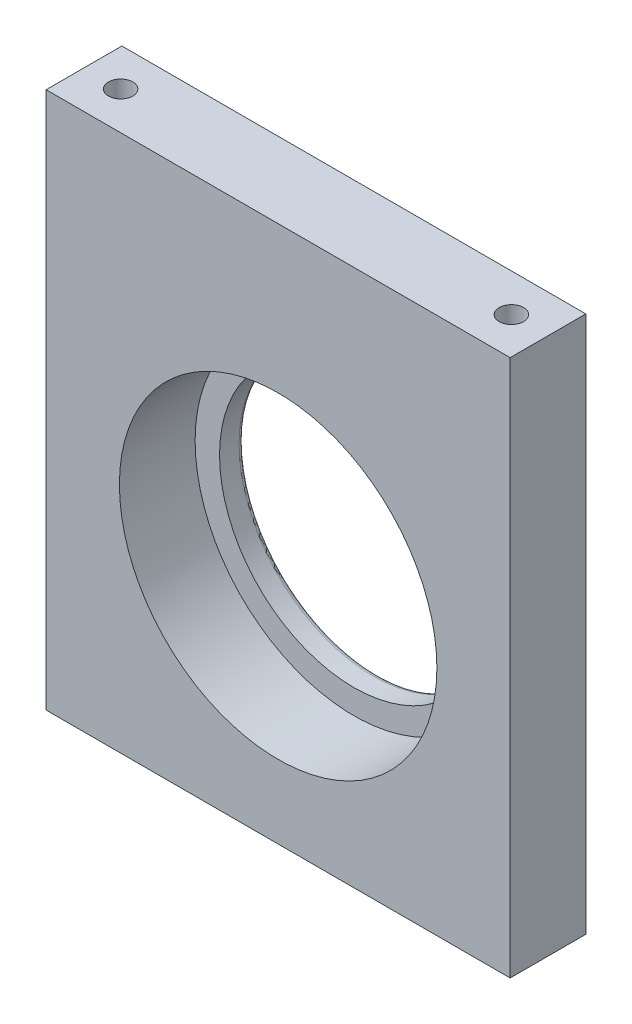
from build123d import *

# Parameters (mm, degrees)
ESQUISSE1_W             = 190
ESQUISSE1_H             = 220
BOSS_EXTRU_1_DEPTH      = 31
ESQUISSE2_R             = 65
ENL_V_MAT_EXTRU_1_DEPTH = 38
ESQUISSE3_R             = 5
ENL_V_MAT_EXTRU_2_DEPTH = 30
ESQUISSE4_W             = 150
ESQUISSE4_H             = 150
ESQUISSE4_R             = 55
BOSS_EXTRU_2_DEPTH      = 10
CONG_1_R                = 2
CONG_2_R                = 2


with BuildPart() as part:
    # Esquisse1 → Boss.-Extru.1 (new body)
    with BuildSketch(Plane.XY):
        with Locations((0, 110)):
            Rectangle(ESQUISSE1_W, ESQUISSE1_H)
    extrude(amount=-BOSS_EXTRU_1_DEPTH)

    # Esquisse2 → Enlèv. mat.-Extru.1 (cut)
    with BuildSketch(Plane.XY):
        with Locations((0, 95)):
            Circle(ESQUISSE2_R)
    extrude(amount=-ENL_V_MAT_EXTRU_1_DEPTH, mode=Mode.SUBTRACT)

    # Esquisse3 → Enlèv. mat.-Extru.2 (cut)
    with BuildSketch(Plane(origin=(0, 220, 0), x_dir=(1, 0, 0), z_dir=(0, 1, 0))):
        with Locations(Location((-80, 15.5, 0), (0, 0, 270))):
            Circle(ESQUISSE3_R)
    enl_v_mat_extru_2 = extrude(amount=-ENL_V_MAT_EXTRU_2_DEPTH, mode=Mode.SUBTRACT)

    # Symétrie1: Enlèv. mat.-Extru.2 across plane
    add(enl_v_mat_extru_2.mirror(Plane(origin=(0, 0, 0), x_dir=(0, 0, 1), z_dir=(1, 0, 0))), mode=Mode.SUBTRACT)

    # Esquisse4 → Boss.-Extru.2 (add)
    with BuildSketch(Plane(origin=(0, 0, -31), x_dir=(-1, 0, 0), z_dir=(0, 0, -1))):
        with Locations((0, 95)):
            Rectangle(ESQUISSE4_W, ESQUISSE4_H)
        with Locations((0, 95)):
            Circle(ESQUISSE4_R, mode=Mode.SUBTRACT)
    extrude(amount=BOSS_EXTRU_2_DEPTH)

    # Congé1
    cong_1_edges = [part.edges().sort_by_distance(p)[0] for p in [
        (-75, 95, -31),
        (0, 170, -31),
        (75, 95, -31),
        (0, 20, -31),
    ]]
    fillet(cong_1_edges, radius=CONG_1_R)

    # Congé2
    cong_2_edges = [part.edges().sort_by_distance(p)[0] for p in [
        (55, 95, -41),
    ]]
    fillet(cong_2_edges, radius=CONG_2_R)


solid = part.part
